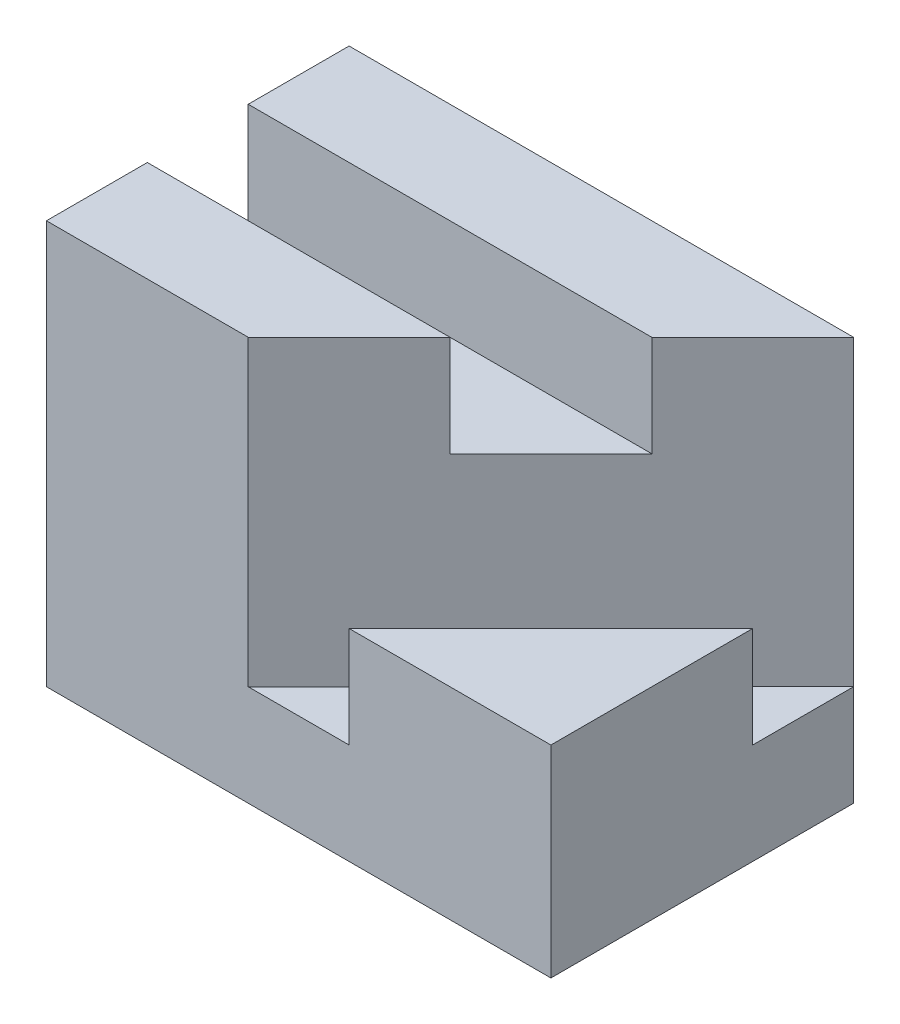
from build123d import *

# Parameters (mm, degrees)
BOSS_EXTRUDE1_DEPTH = 50
CUT_EXTRUDE1_DEPTH  = 20
CUT_EXTRUDE2_DEPTH  = 30


with BuildPart() as part:
    # Sketch1 → Boss-Extrude1 (new body)
    with BuildSketch(Plane(origin=(0, 0, 0), x_dir=(0, 0, -1), z_dir=(1, 0, 0))):
        Polygon((-23.59223301, 10), (-23.59223301, -30), (6.40776699, -30), (6.40776699, 10), (-3.59223301, 10), (-3.59223301, 0), (-13.59223301, 0), (-13.59223301, 10), align=None)
    extrude(amount=BOSS_EXTRUDE1_DEPTH)

    # Sketch2 → Cut-Extrude1 (cut)
    with BuildSketch(Plane(origin=(0, 10, 0), x_dir=(1, 0, 0), z_dir=(0, 1, 0))):
        Polygon((50, -3.59223301), (30, -23.59223301), (50, -23.59223301), align=None)
    extrude(amount=-CUT_EXTRUDE1_DEPTH, mode=Mode.SUBTRACT)

    # Sketch3 → Cut-Extrude2 (cut)
    with BuildSketch(Plane(origin=(0, 10, 0), x_dir=(1, 0, 0), z_dir=(0, 1, 0))):
        Polygon((50, -3.59223301), (30, -23.59223301), (20, -23.59223301), (50, 6.40776699), align=None)
    extrude(amount=-CUT_EXTRUDE2_DEPTH, mode=Mode.SUBTRACT)


solid = part.part
